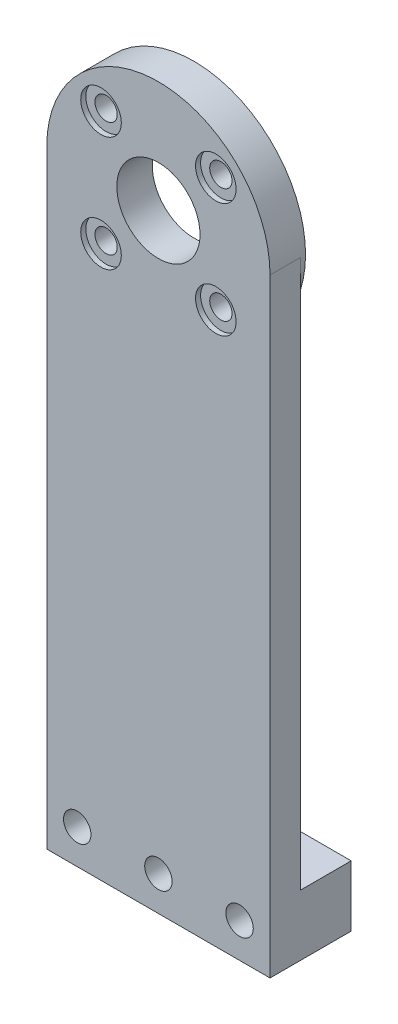
from build123d import *

# Parameters (mm, degrees)
BOSS_EXTRUDE1_DEPTH = 3
BOSS_EXTRUDE2_START = -0.5
SKETCH1_3_R         = 11
BOSS_EXTRUDE2_DEPTH = 0.5
SKETCH2_R           = 4.1
SKETCH2_R_2         = 1.1
CUT_EXTRUDE1_DEPTH  = 3.5
SKETCH2_3_R         = 2
CUT_EXTRUDE2_DEPTH  = 0.5
CIRPATTERN2_COUNT   = 4
SKETCH1_6_W         = 11
SKETCH1_6_H         = 6
BOSS_EXTRUDE3_DEPTH = 5
SKETCH4_R           = 1.35
CUT_EXTRUDE4_DEPTH  = 8
LPATTERN2_COUNT     = 2
LPATTERN2_PITCH     = 8
LPATTERN2_COL_COUNT = 2
LPATTERN2_COL_PITCH = 8


with BuildPart() as part:
    # Sketch1 → Boss-Extrude1 (new body)
    with BuildSketch(Plane.XY):
        with BuildLine():
            Line((-11, 30), (-11, -30))
            Line((-11, -30), (11, -30))
            Line((11, -30), (11, 30))
            ThreePointArc((11, 30), (0, 41), (-11, 30))
        make_face()
    extrude(amount=BOSS_EXTRUDE1_DEPTH)

    # Sketch1<3> → Boss-Extrude2 (add)
    with BuildSketch(Plane.XY.offset(BOSS_EXTRUDE2_START)):
        with Locations((0, 30)):
            Circle(SKETCH1_3_R)
    extrude(amount=BOSS_EXTRUDE2_DEPTH)

    # Sketch2 → Cut-Extrude1 (cut)
    with BuildSketch(Plane.XY.offset(3)):
        with Locations((0, 30)):
            Circle(SKETCH2_R)
        with Locations((5.656854249, 35.656854249)):
            Circle(SKETCH2_R_2)
    cut_extrude1 = extrude(amount=-CUT_EXTRUDE1_DEPTH, mode=Mode.SUBTRACT)

    # Sketch2<3> → Cut-Extrude2 (cut)
    with BuildSketch(Plane.XY.offset(3)):
        with Locations((5.656854249, 35.656854249)):
            Circle(SKETCH2_3_R)
    cut_extrude2 = extrude(amount=-CUT_EXTRUDE2_DEPTH, mode=Mode.SUBTRACT)

    # CirPattern2: Cut-Extrude1, Cut-Extrude2 ×4 about axis
    cirpattern2_axis = Axis((0, 30, 0), (0, 0, 1))
    add([cut_extrude1.rotate(cirpattern2_axis, i * 360 / CIRPATTERN2_COUNT) for i in range(1, CIRPATTERN2_COUNT)], mode=Mode.SUBTRACT)
    add([cut_extrude2.rotate(cirpattern2_axis, i * 360 / CIRPATTERN2_COUNT) for i in range(1, CIRPATTERN2_COUNT)], mode=Mode.SUBTRACT)

    # Sketch1<6> → Boss-Extrude3 (add)
    with BuildSketch(Plane.XY):
        with Locations((-5.5, -27)):
            Rectangle(SKETCH1_6_W, SKETCH1_6_H)
        with Locations((5.5, -27)):
            Rectangle(SKETCH1_6_W, SKETCH1_6_H)
    extrude(amount=-BOSS_EXTRUDE3_DEPTH)

    # Sketch4 → Cut-Extrude4 (cut)
    with BuildSketch(Plane.XY.offset(3)):
        with Locations((0, -26.6)):
            Circle(SKETCH4_R)
    cut_extrude4 = extrude(amount=-CUT_EXTRUDE4_DEPTH, mode=Mode.SUBTRACT)

    # LPattern2: Cut-Extrude4 ×2
    with Locations(*[(i * LPATTERN2_PITCH, 0, 0) for i in range(1, LPATTERN2_COUNT)]):
        add(cut_extrude4, mode=Mode.SUBTRACT)

    # LPattern2 col: Cut-Extrude4 ×2
    with Locations(*[(-i * LPATTERN2_COL_PITCH, 0, 0) for i in range(1, LPATTERN2_COL_COUNT)]):
        add(cut_extrude4, mode=Mode.SUBTRACT)


solid = part.part
